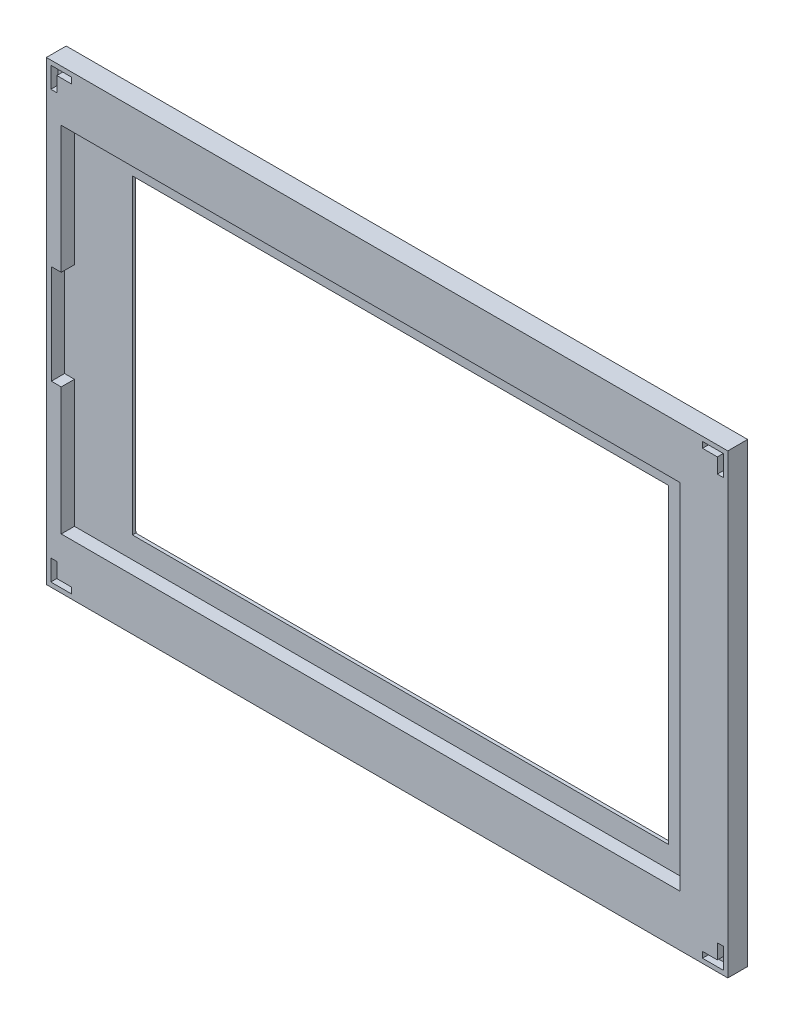
from build123d import *

# Parameters (mm, degrees)
SKETCH1_W           = 103
SKETCH1_H           = 69
BOSS_EXTRUDE1_DEPTH = 3
SKETCH2_W           = 81
SKETCH2_H           = 47
CUT_EXTRUDE1_DEPTH  = 3
CUT_EXTRUDE2_DEPTH  = 2
CHAMFER1_SIZE       = 0.5
FILLET1_R           = 0.5
CUT_EXTRUDE3_DEPTH  = 1.1


with BuildPart() as part:
    # Sketch1 → Boss-Extrude1 (new body)
    with BuildSketch(Plane.XY):
        with Locations((62.328366078, 28.443882797)):
            Rectangle(SKETCH1_W, SKETCH1_H)
    extrude(amount=BOSS_EXTRUDE1_DEPTH)

    # Sketch2 → Cut-Extrude1 (cut)
    with BuildSketch(Plane.XY.offset(3)):
        with Locations((62.328366078, 28.443882797)):
            Rectangle(SKETCH2_W, SKETCH2_H)
    extrude(amount=-CUT_EXTRUDE1_DEPTH, mode=Mode.SUBTRACT)

    # Sketch3 → Cut-Extrude2 (cut)
    with BuildSketch(Plane.XY.offset(3)):
        Polygon((13.078366078, 55.193882797), (106.578366078, 55.193882797), (106.578366078, 1.693882797), (13.078366078, 1.693882797), (13.078366078, 20.943882797), (11.578366078, 20.943882797), (11.578366078, 35.943882797), (13.078366078, 35.943882797), align=None)
    extrude(amount=-CUT_EXTRUDE2_DEPTH, mode=Mode.SUBTRACT)

    # Chamfer1
    chamfer1_edges = [part.edges().sort_by_distance(p)[0] for p in [
        (21.828366078, 28.443882797, 0),
        (62.328366078, 51.943882797, 0),
        (102.828366078, 28.443882797, 0),
        (62.328366078, 4.943882797, 0),
    ]]
    chamfer(chamfer1_edges, length=CHAMFER1_SIZE)

    # Fillet1
    fillet1_edges = [part.edges().sort_by_distance(p)[0] for p in [
        (21.578366078, 52.193882797, 0.25),
        (103.078366078, 52.193882797, 0.25),
        (21.578366078, 4.693882797, 0.25),
        (103.078366078, 4.693882797, 0.25),
    ]]
    fillet(fillet1_edges, radius=FILLET1_R)

    # Sketch4 → Cut-Extrude3 (cut)
    with BuildSketch(Plane.XY.offset(3)):
        Polygon((11.503366078, 62.268882797), (14.653366078, 62.268882797), (14.653366078, 61.368882797), (12.403366078, 61.368882797), (12.403366078, 59.118882797), (11.503366078, 59.118882797), align=None)
        Polygon((113.153366078, 59.118882797), (113.153366078, 62.268882797), (110.003366078, 62.268882797), (110.003366078, 61.368882797), (112.253366078, 61.368882797), (112.253366078, 59.118882797), align=None)
        Polygon((113.153366078, -5.381117203), (110.003366078, -5.381117203), (110.003366078, -4.481117203), (112.253366078, -4.481117203), (112.253366078, -2.231117203), (113.153366078, -2.231117203), align=None)
        Polygon((11.503366078, -2.231117203), (11.503366078, -5.381117203), (14.653366078, -5.381117203), (14.653366078, -4.481117203), (12.403366078, -4.481117203), (12.403366078, -2.231117203), align=None)
    extrude(amount=-CUT_EXTRUDE3_DEPTH, mode=Mode.SUBTRACT)


solid = part.part
